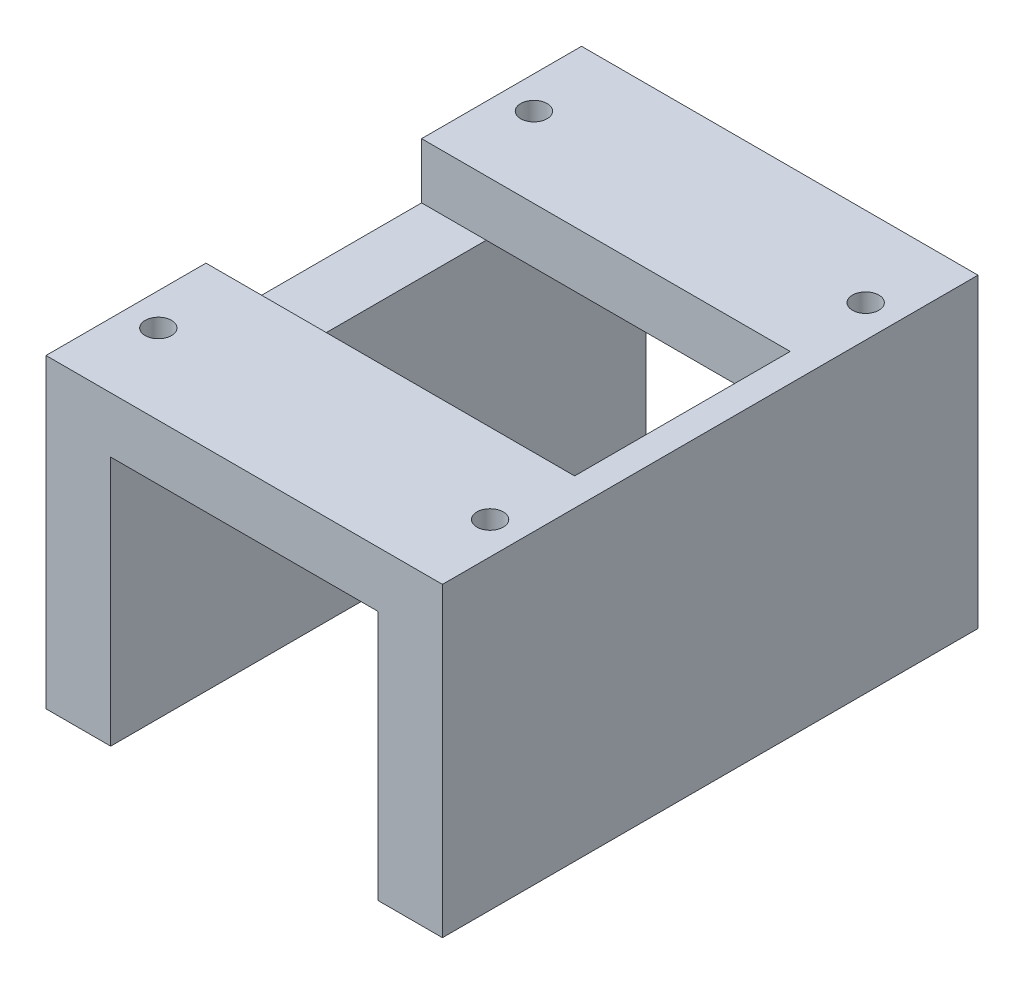
from build123d import *

# Parameters (mm, degrees)
SKETCH1_W           = 57
SKETCH1_H           = 37
BOSS_EXTRUDE1_DEPTH = 44
SKETCH2_W           = 38.4
SKETCH2_H           = 36
CUT_EXTRUDE1_DEPTH  = 47
SKETCH4_R           = 1.9
CUT_EXTRUDE3_DEPTH  = 30
BOSS_EXTRUDE2_DEPTH = 20
BOSS_EXTRUDE3_DEPTH = 20
SKETCH7_W           = 53
SKETCH7_H           = 31
CUT_EXTRUDE4_DEPTH  = 8
SKETCH8_R           = 1.9
CUT_EXTRUDE5_DEPTH  = 25


with BuildPart() as part:
    # Sketch1 → Boss-Extrude1 (new body)
    with BuildSketch(Plane(origin=(0, 0, 0), x_dir=(1, 0, 0), z_dir=(0, 1, 0))):
        Rectangle(SKETCH1_W, SKETCH1_H)
    extrude(amount=BOSS_EXTRUDE1_DEPTH)

    # Sketch2 → Cut-Extrude1 (cut)
    with BuildSketch(Plane.XY.offset(18.5)):
        with Locations((0, 18)):
            Rectangle(SKETCH2_W, SKETCH2_H)
    extrude(amount=-CUT_EXTRUDE1_DEPTH, mode=Mode.SUBTRACT)

    # Sketch4 → Cut-Extrude3 (cut)
    with BuildSketch(Plane.XZ):
        with Locations((23.704806449, 9.5)):
            Circle(SKETCH4_R)
        with Locations((23.704806449, -8.5)):
            Circle(SKETCH4_R)
        with Locations((-23.5, 9.5)):
            Circle(SKETCH4_R)
        with Locations((-23.5, -8.5)):
            Circle(SKETCH4_R)
    extrude(amount=-CUT_EXTRUDE3_DEPTH, mode=Mode.SUBTRACT)

    # Sketch5 → Boss-Extrude2 (add)
    with BuildSketch(Plane(origin=(0, 0, -18.5), x_dir=(-1, 0, 0), z_dir=(0, 0, -1))):
        Polygon((-19.2, 36), (19.2, 36), (19.2, 0), (28.5, 0), (28.5, 44), (-28.5, 44), (-28.5, 0), (-19.2, 0), align=None)
    extrude(amount=BOSS_EXTRUDE2_DEPTH)

    # Sketch6 → Boss-Extrude3 (add)
    with BuildSketch(Plane.XY.offset(18.5)):
        Polygon((-28.5, 0), (-19.2, 0), (-19.2, 36), (19.2, 36), (19.2, 0), (28.5, 0), (28.5, 44), (-28.5, 44), align=None)
    extrude(amount=BOSS_EXTRUDE3_DEPTH)

    # Sketch7 → Cut-Extrude4 (cut)
    with BuildSketch(Plane(origin=(0, 44, 0), x_dir=(1, 0, 0), z_dir=(0, 1, 0))):
        with Locations((-2, 0)):
            Rectangle(SKETCH7_W, SKETCH7_H)
    extrude(amount=-CUT_EXTRUDE4_DEPTH, mode=Mode.SUBTRACT)

    # Sketch8 → Cut-Extrude5 (cut)
    with BuildSketch(Plane(origin=(0, 44, 0), x_dir=(1, 0, 0), z_dir=(0, 1, 0))):
        with Locations((-23.85, 27)):
            Circle(SKETCH8_R)
        with Locations((23.85, 27)):
            Circle(SKETCH8_R)
        with Locations((-23.85, -27)):
            Circle(SKETCH8_R)
        with Locations((23.85, -27)):
            Circle(SKETCH8_R)
    extrude(amount=-CUT_EXTRUDE5_DEPTH, mode=Mode.SUBTRACT)


solid = part.part
